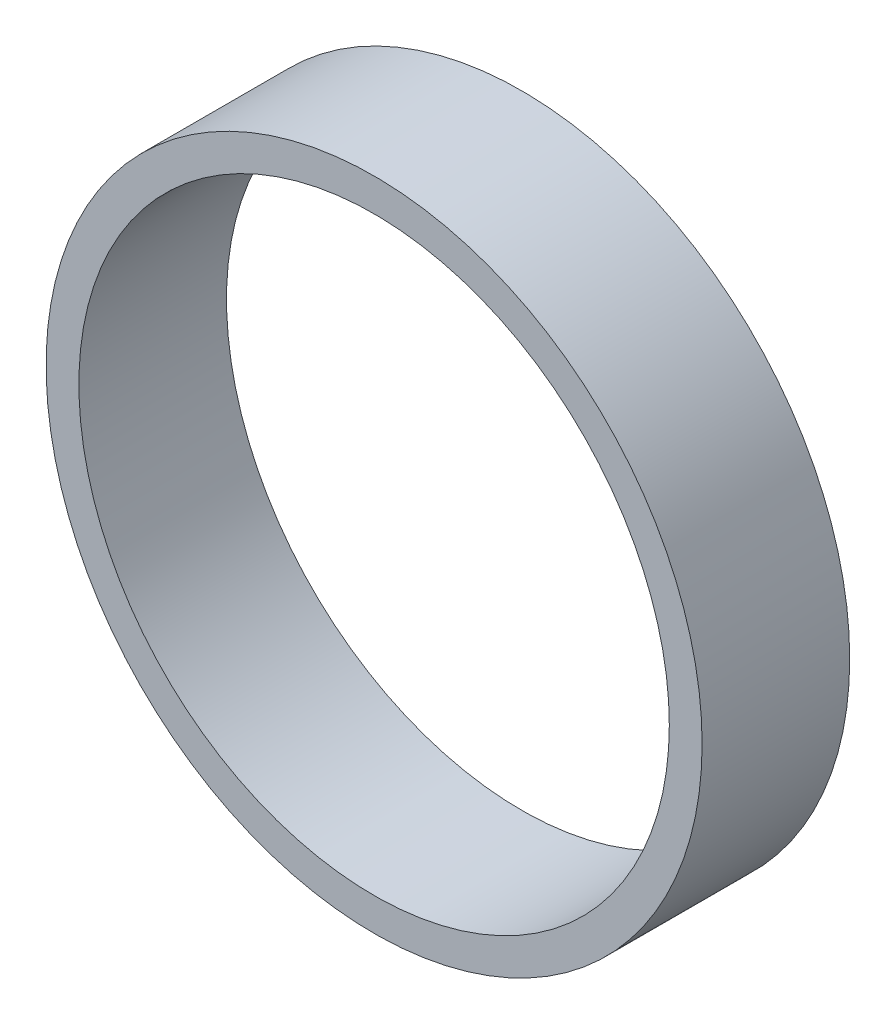
from build123d import *

# Parameters (mm, degrees)
SKETCH1_R           = 25.4
BOSS_EXTRUDE1_DEPTH = 11.43
SKETCH2_R           = 22.86
CUT_EXTRUDE1_DEPTH  = 38.695688082


with BuildPart() as part:
    # Sketch1 → Boss-Extrude1 (new body)
    with BuildSketch(Plane.XY):
        Circle(SKETCH1_R)
    extrude(amount=BOSS_EXTRUDE1_DEPTH)

    # Sketch2 → Cut-Extrude1 (cut, through all)
    with BuildSketch(Plane.XY.offset(11.43)):
        Circle(SKETCH2_R)
    extrude(amount=-CUT_EXTRUDE1_DEPTH, mode=Mode.SUBTRACT)


solid = part.part
